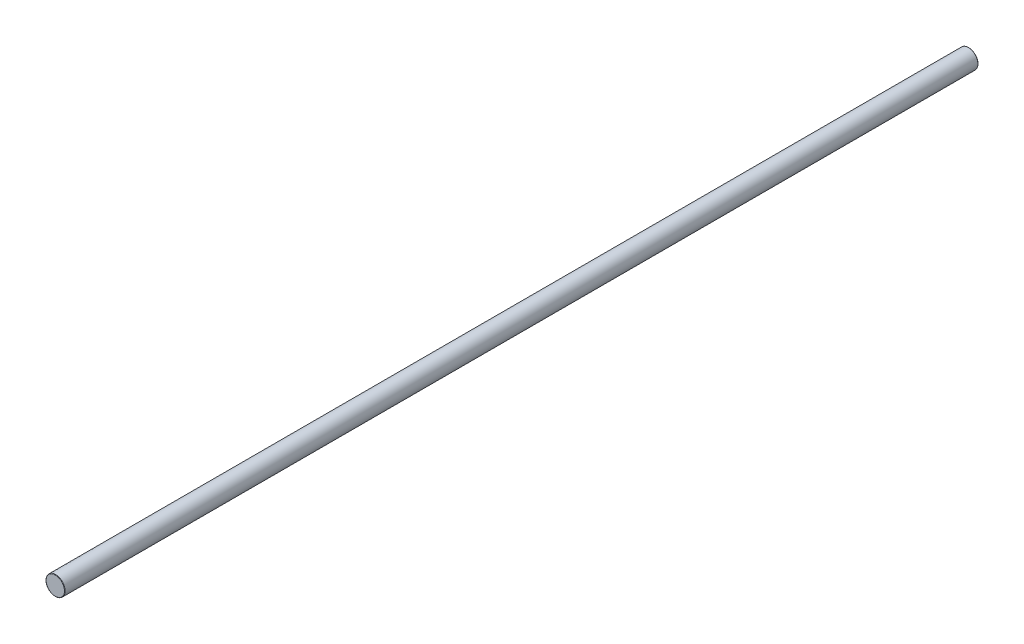
from build123d import *

# Parameters (mm, degrees)
SKETCH1_R           = 6.35
BOSS_EXTRUDE1_DEPTH = 609.6
FILLET1_R           = 0.25


with BuildPart() as part:
    # Sketch1 → Boss-Extrude1 (new body)
    with BuildSketch(Plane.XY):
        with Locations(Location((0, 0, 0), (0, 0, 180))):
            Circle(SKETCH1_R)
    extrude(amount=BOSS_EXTRUDE1_DEPTH)

    # Fillet1
    fillet1_edges = [part.edges().sort_by_distance(p)[0] for p in [
        (6.35, 0, 0),
        (6.35, 0, 609.6),
    ]]
    fillet(fillet1_edges, radius=FILLET1_R)


solid = part.part
